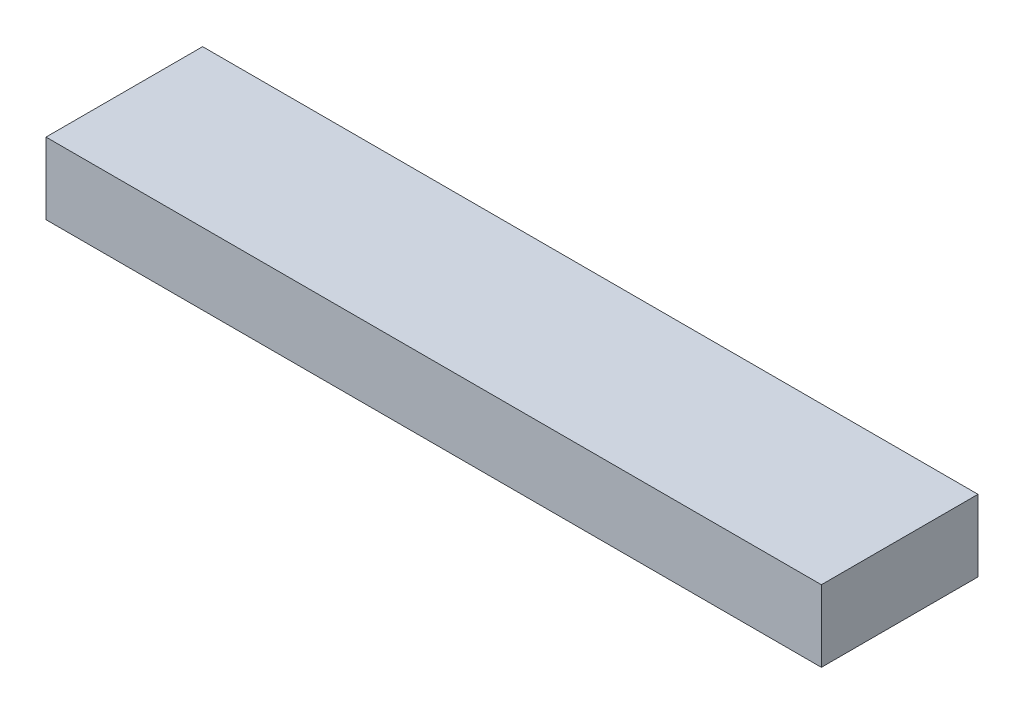
from build123d import *

# Parameters (mm, degrees)
SKETCH1_W           = 65
SKETCH1_H           = 6
BOSS_EXTRUDE1_DEPTH = 13.130276829


with BuildPart() as part:
    # Sketch1 → Boss-Extrude1 (new body)
    with BuildSketch(Plane.XY):
        Rectangle(SKETCH1_W, SKETCH1_H)
    extrude(amount=BOSS_EXTRUDE1_DEPTH)


solid = part.part
